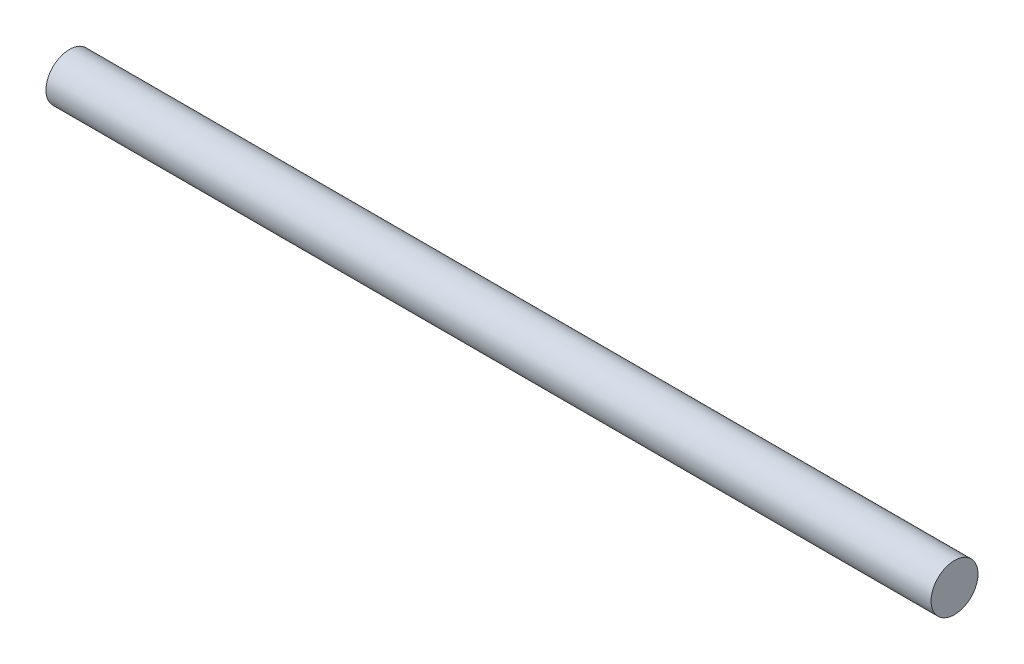
from build123d import *

# Parameters (mm, degrees)
BAR_SKETCH_R = 9.525
BAR_DEPTH    = 179.52


with BuildPart() as part:
    # bar sketch → bar (new, symmetric)
    with BuildSketch(Plane(origin=(0, 0, 0), x_dir=(0, 0, -1), z_dir=(1, 0, 0))):
        with Locations((10, 352.4)):
            Circle(BAR_SKETCH_R)
    extrude(amount=BAR_DEPTH, both=True)


solid = part.part
